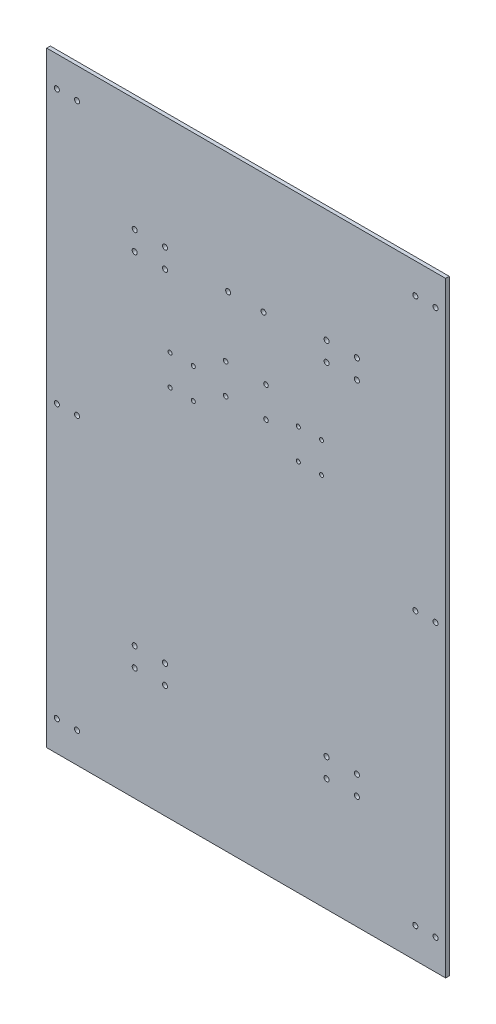
from build123d import *

# Parameters (mm, degrees)
SKETCH_1_W          = 395
SKETCH_1_H          = 600
EXTRUDE_1_DEPTH     = 3.6
SKETCH_4_R          = 2.5
CUT_EXTRUDE_3_DEPTH = 3.6
SKETCH_5_R          = 2
CUT_EXTRUDE_4_DEPTH = 10
SKETCH_6_R          = 2
CUT_EXTRUDE_5_DEPTH = 10
SKETCH_7_R          = 2.5
CUT_EXTRUDE_6_DEPTH = 10
SKETCH_8_R          = 2.25
CUT_EXTRUDE_7_DEPTH = 376.017279602
SKETCH_9_R          = 2.5
CUT_EXTRUDE_8_DEPTH = 376.017279602


with BuildPart() as part:
    # 草图1 → 凸台-拉伸1 (new body)
    with BuildSketch(Plane.XY):
        with Locations((-27.5, 0)):
            Rectangle(SKETCH_1_W, SKETCH_1_H)
    extrude(amount=EXTRUDE_1_DEPTH)

    # 草图4 → 切除-拉伸3 (cut)
    with BuildSketch(Plane.XY.offset(3.6)):
        with Locations((-195, 270)):
            Circle(SKETCH_4_R)
        with Locations((-195, -270)):
            Circle(SKETCH_4_R)
        with Locations((-195, 0)):
            Circle(SKETCH_4_R)
        with Locations(Location((-215, -270, 0), (0, 0, 180))):
            Circle(SKETCH_4_R)
        with Locations(Location((-215, 0, 0), (0, 0, 180))):
            Circle(SKETCH_4_R)
        with Locations(Location((-215, 270, 0), (0, 0, 180))):
            Circle(SKETCH_4_R)
    cut_extrude_3 = extrude(amount=-CUT_EXTRUDE_3_DEPTH, mode=Mode.SUBTRACT)

    # 草图5 → 切除-拉伸4 (cut)
    with BuildSketch(Plane.XY.offset(3.6)):
        with Locations((-102.883860642, 69.955951215)):
            Circle(SKETCH_5_R)
        with Locations((-102.883860642, 99.955951215)):
            Circle(SKETCH_5_R)
        with Locations((-79.883860642, 69.955951215)):
            Circle(SKETCH_5_R)
        with Locations((-79.883860642, 99.955951215)):
            Circle(SKETCH_5_R)
    extrude(amount=-CUT_EXTRUDE_4_DEPTH, mode=Mode.SUBTRACT)

    # 草图6 → 切除-拉伸5 (cut)
    with BuildSketch(Plane.XY.offset(3.6)):
        with Locations((24.116139358, 69.955951215)):
            Circle(SKETCH_6_R)
        with Locations((24.116139358, 99.955951215)):
            Circle(SKETCH_6_R)
        with Locations((47.116139358, 69.955951215)):
            Circle(SKETCH_6_R)
        with Locations((47.116139358, 99.955951215)):
            Circle(SKETCH_6_R)
    extrude(amount=-CUT_EXTRUDE_5_DEPTH, mode=Mode.SUBTRACT)

    # 草图7 → 切除-拉伸6 (cut)
    with BuildSketch(Plane.XY.offset(3.6)):
        with Locations((-45.383860642, 180.955951215)):
            Circle(SKETCH_7_R)
        with Locations((-10.383860642, 180.955951215)):
            Circle(SKETCH_7_R)
    extrude(amount=-CUT_EXTRUDE_6_DEPTH, mode=Mode.SUBTRACT)

    # 草图8 → 切除-拉伸7 (cut, through all)
    with BuildSketch(Plane.XY.offset(3.6)):
        with Locations((-47.883860642, 89.955951215)):
            Circle(SKETCH_8_R)
        with Locations((-47.883860642, 119.955951215)):
            Circle(SKETCH_8_R)
        with Locations((-7.883860642, 89.955951215)):
            Circle(SKETCH_8_R)
        with Locations((-7.883860642, 119.955951215)):
            Circle(SKETCH_8_R)
    extrude(amount=-CUT_EXTRUDE_7_DEPTH, mode=Mode.SUBTRACT)

    # 草图9 → 切除-拉伸8 (cut, through all)
    with BuildSketch(Plane.XY.offset(3.6)):
        with Locations((-137.883860642, -188.044048785)):
            Circle(SKETCH_9_R)
        with Locations((-137.883860642, -169.044048785)):
            Circle(SKETCH_9_R)
        with Locations((-107.883860642, -188.044048785)):
            Circle(SKETCH_9_R)
        with Locations((-107.883860642, -169.044048785)):
            Circle(SKETCH_9_R)
        with Locations((52.116139358, -188.044048785)):
            Circle(SKETCH_9_R)
        with Locations((52.116139358, -169.044048785)):
            Circle(SKETCH_9_R)
        with Locations((82.116139358, -169.044048785)):
            Circle(SKETCH_9_R)
        with Locations((82.116139358, -188.044048785)):
            Circle(SKETCH_9_R)
        with Locations((82.116139358, 168.955951215)):
            Circle(SKETCH_9_R)
        with Locations((82.116139358, 187.955951215)):
            Circle(SKETCH_9_R)
        with Locations((52.116139358, 168.955951215)):
            Circle(SKETCH_9_R)
        with Locations((52.116139358, 187.955951215)):
            Circle(SKETCH_9_R)
        with Locations((-107.883860642, 168.955951215)):
            Circle(SKETCH_9_R)
        with Locations((-107.883860642, 187.955951215)):
            Circle(SKETCH_9_R)
        with Locations((-137.883860642, 168.955951215)):
            Circle(SKETCH_9_R)
        with Locations((-137.883860642, 187.955951215)):
            Circle(SKETCH_9_R)
    extrude(amount=-CUT_EXTRUDE_8_DEPTH, mode=Mode.SUBTRACT)

    # 镜向1: 切除-拉伸3 across plane
    add(cut_extrude_3.mirror(Plane.ZY.offset(27.5)), mode=Mode.SUBTRACT)


solid = part.part
